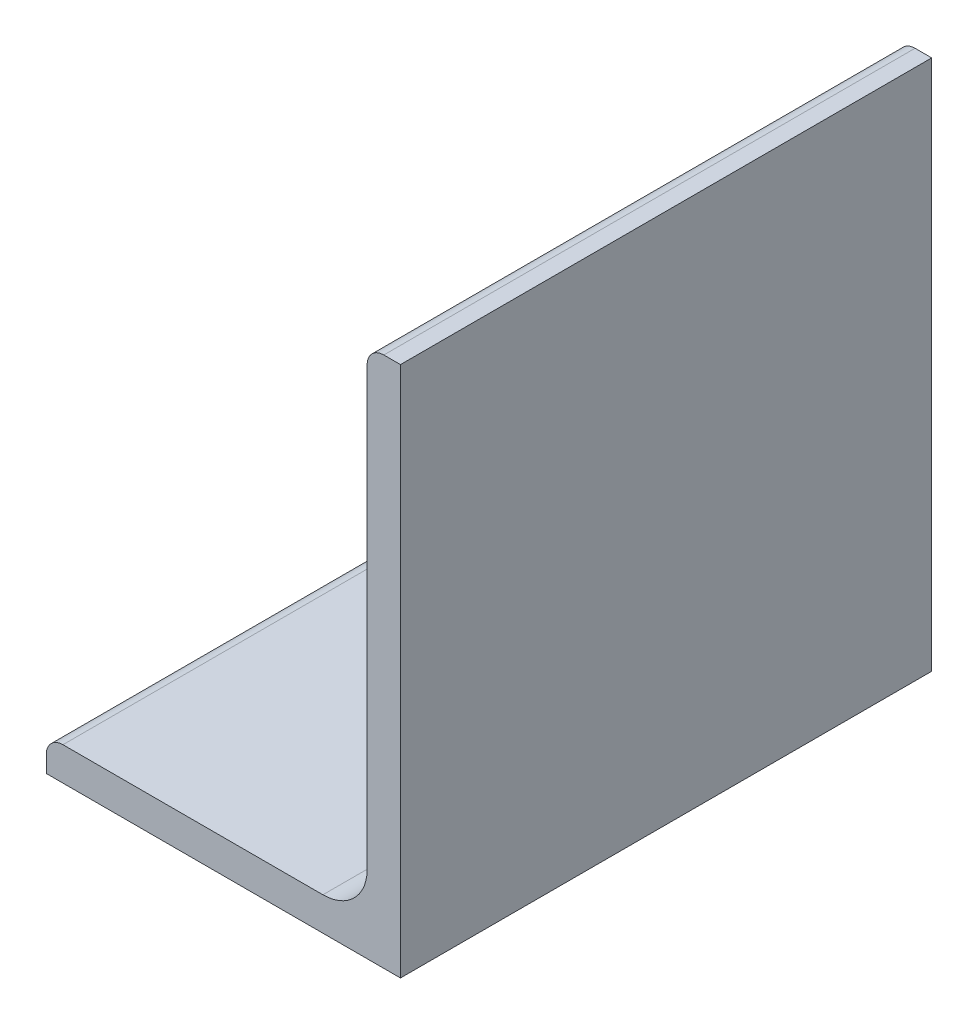
from build123d import *

# Parameters (mm, degrees)
BOSS_EXTRUDE1_DEPTH = 38.1


with BuildPart() as part:
    # Sketch2 → Boss-Extrude1 (new, symmetric)
    with BuildSketch(Plane.XY):
        with BuildLine():
            Line((-25.4, 0), (25.4, 0))
            Line((25.4, 0), (25.4, 76.2))
            Line((25.4, 76.2), (23.0124, 76.2))
            ThreePointArc((23.0124, 76.2), (21.324111849, 75.500688151), (20.6248, 73.8124))
            Line((20.6248, 73.8124), (20.6248, 11.1252))
            ThreePointArc((20.6248, 11.1252), (18.764928061, 6.635071939), (14.2748, 4.7752))
            Line((14.2748, 4.7752), (-23.0124, 4.7752))
            ThreePointArc((-23.0124, 4.7752), (-24.700688151, 4.075888151), (-25.4, 2.3876))
            Line((-25.4, 2.3876), (-25.4, 0))
        make_face()
    extrude(amount=BOSS_EXTRUDE1_DEPTH, both=True)


solid = part.part
